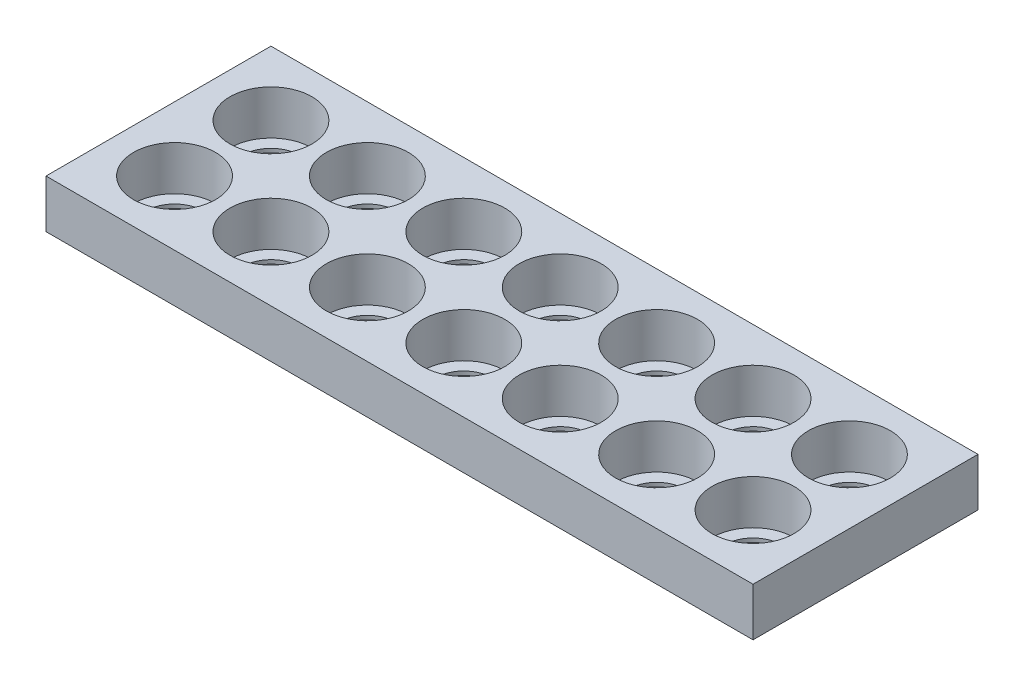
from build123d import *

# Parameters (mm, degrees)
SKETCH1_W           = 186.266666666
SKETCH1_H           = 59.266666666
SKETCH1_R           = 10.8
BOSS_EXTRUDE2_DEPTH = 12.7
SKETCH1_4_R         = 10.8
SKETCH1_4_R_2       = 7.5
BOSS_EXTRUDE3_DEPTH = 1.016


with BuildPart() as part:
    # Sketch1 → Boss-Extrude2 (new body)
    with BuildSketch(Plane(origin=(0, 0, 0), x_dir=(1, 0, 0), z_dir=(0, 1, 0))):
        with Locations((76.2, 12.7)):
            Rectangle(SKETCH1_W, SKETCH1_H)
        Circle(SKETCH1_R, mode=Mode.SUBTRACT)
        with Locations((25.4, 0)):
            Circle(SKETCH1_R, mode=Mode.SUBTRACT)
        with Locations((50.8, 0)):
            Circle(SKETCH1_R, mode=Mode.SUBTRACT)
        with Locations((76.2, 0)):
            Circle(SKETCH1_R, mode=Mode.SUBTRACT)
        with Locations((101.6, 0)):
            Circle(SKETCH1_R, mode=Mode.SUBTRACT)
        with Locations((127, 0)):
            Circle(SKETCH1_R, mode=Mode.SUBTRACT)
        with Locations((152.4, 0)):
            Circle(SKETCH1_R, mode=Mode.SUBTRACT)
        with Locations((0, 25.4)):
            Circle(SKETCH1_R, mode=Mode.SUBTRACT)
        with Locations((25.4, 25.4)):
            Circle(SKETCH1_R, mode=Mode.SUBTRACT)
        with Locations((50.8, 25.4)):
            Circle(SKETCH1_R, mode=Mode.SUBTRACT)
        with Locations((76.2, 25.4)):
            Circle(SKETCH1_R, mode=Mode.SUBTRACT)
        with Locations((101.6, 25.4)):
            Circle(SKETCH1_R, mode=Mode.SUBTRACT)
        with Locations((127, 25.4)):
            Circle(SKETCH1_R, mode=Mode.SUBTRACT)
        with Locations((152.4, 25.4)):
            Circle(SKETCH1_R, mode=Mode.SUBTRACT)
    extrude(amount=BOSS_EXTRUDE2_DEPTH)

    # Sketch1<4> → Boss-Extrude3 (add)
    # profile 1 of 14: a face of its own
    with BuildSketch(Plane(origin=(0, 0, 0), x_dir=(1, 0, 0), z_dir=(0, 1, 0))):
        Circle(SKETCH1_4_R)
        Circle(SKETCH1_4_R_2, mode=Mode.SUBTRACT)
    # profile 2 of 14: a face of its own
    with BuildSketch(Plane(origin=(0, 0, 0), x_dir=(1, 0, 0), z_dir=(0, 1, 0))):
        with Locations((25.4, 0)):
            Circle(SKETCH1_4_R)
        with Locations((25.4, 0)):
            Circle(SKETCH1_4_R_2, mode=Mode.SUBTRACT)
    # profile 3 of 14: a face of its own
    with BuildSketch(Plane(origin=(0, 0, 0), x_dir=(1, 0, 0), z_dir=(0, 1, 0))):
        with Locations((50.8, 0)):
            Circle(SKETCH1_4_R)
        with Locations((50.8, 0)):
            Circle(SKETCH1_4_R_2, mode=Mode.SUBTRACT)
    # profile 4 of 14: a face of its own
    with BuildSketch(Plane(origin=(0, 0, 0), x_dir=(1, 0, 0), z_dir=(0, 1, 0))):
        with Locations((76.2, 0)):
            Circle(SKETCH1_4_R)
        with Locations((76.2, 0)):
            Circle(SKETCH1_4_R_2, mode=Mode.SUBTRACT)
    # profile 5 of 14: a face of its own
    with BuildSketch(Plane(origin=(0, 0, 0), x_dir=(1, 0, 0), z_dir=(0, 1, 0))):
        with Locations((101.6, 0)):
            Circle(SKETCH1_4_R)
        with Locations((101.6, 0)):
            Circle(SKETCH1_4_R_2, mode=Mode.SUBTRACT)
    # profile 6 of 14: a face of its own
    with BuildSketch(Plane(origin=(0, 0, 0), x_dir=(1, 0, 0), z_dir=(0, 1, 0))):
        with Locations((127, 0)):
            Circle(SKETCH1_4_R)
        with Locations((127, 0)):
            Circle(SKETCH1_4_R_2, mode=Mode.SUBTRACT)
    # profile 7 of 14: a face of its own
    with BuildSketch(Plane(origin=(0, 0, 0), x_dir=(1, 0, 0), z_dir=(0, 1, 0))):
        with Locations((152.4, 0)):
            Circle(SKETCH1_4_R)
        with Locations((152.4, 0)):
            Circle(SKETCH1_4_R_2, mode=Mode.SUBTRACT)
    # profile 8 of 14: a face of its own
    with BuildSketch(Plane(origin=(0, 0, 0), x_dir=(1, 0, 0), z_dir=(0, 1, 0))):
        with Locations((25.4, 25.4)):
            Circle(SKETCH1_4_R)
        with Locations((25.4, 25.4)):
            Circle(SKETCH1_4_R_2, mode=Mode.SUBTRACT)
    # profile 9 of 14: a face of its own
    with BuildSketch(Plane(origin=(0, 0, 0), x_dir=(1, 0, 0), z_dir=(0, 1, 0))):
        with Locations((50.8, 25.4)):
            Circle(SKETCH1_4_R)
        with Locations((50.8, 25.4)):
            Circle(SKETCH1_4_R_2, mode=Mode.SUBTRACT)
    # profile 10 of 14: a face of its own
    with BuildSketch(Plane(origin=(0, 0, 0), x_dir=(1, 0, 0), z_dir=(0, 1, 0))):
        with Locations((76.2, 25.4)):
            Circle(SKETCH1_4_R)
        with Locations((76.2, 25.4)):
            Circle(SKETCH1_4_R_2, mode=Mode.SUBTRACT)
    # profile 11 of 14: a face of its own
    with BuildSketch(Plane(origin=(0, 0, 0), x_dir=(1, 0, 0), z_dir=(0, 1, 0))):
        with Locations((101.6, 25.4)):
            Circle(SKETCH1_4_R)
        with Locations((101.6, 25.4)):
            Circle(SKETCH1_4_R_2, mode=Mode.SUBTRACT)
    # profile 12 of 14: a face of its own
    with BuildSketch(Plane(origin=(0, 0, 0), x_dir=(1, 0, 0), z_dir=(0, 1, 0))):
        with Locations((127, 25.4)):
            Circle(SKETCH1_4_R)
        with Locations((127, 25.4)):
            Circle(SKETCH1_4_R_2, mode=Mode.SUBTRACT)
    # profile 13 of 14: a face of its own
    with BuildSketch(Plane(origin=(0, 0, 0), x_dir=(1, 0, 0), z_dir=(0, 1, 0))):
        with Locations((152.4, 25.4)):
            Circle(SKETCH1_4_R)
        with Locations((152.4, 25.4)):
            Circle(SKETCH1_4_R_2, mode=Mode.SUBTRACT)
    # profile 14 of 14: a face of its own
    with BuildSketch(Plane(origin=(0, 0, 0), x_dir=(1, 0, 0), z_dir=(0, 1, 0))):
        with Locations((0, 25.4)):
            Circle(SKETCH1_4_R)
        with Locations((0, 25.4)):
            Circle(SKETCH1_4_R_2, mode=Mode.SUBTRACT)
    extrude(amount=BOSS_EXTRUDE3_DEPTH)


solid = part.part
